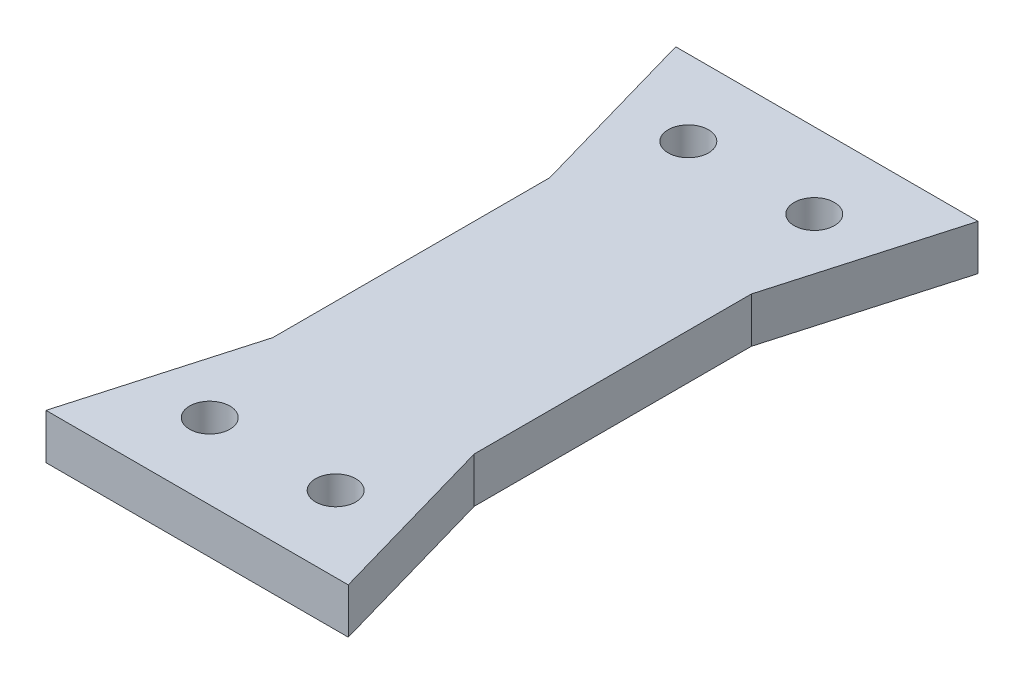
from build123d import *

# Parameters (mm, degrees)
SKETCH1_R           = 4
BOSS_EXTRUDE1_DEPTH = 9


with BuildPart() as part:
    # Sketch1 → Boss-Extrude1 (new body)
    with BuildSketch(Plane(origin=(0, 0, 0), x_dir=(1, 0, 0), z_dir=(0, 1, 0))):
        Polygon((-25, 45), (-30, 62.5), (30, 62.5), (25, 45), (20, 27.5), (20, -27.5), (25, -45), (30, -62.5), (-30, -62.5), (-25, -45), (-20, -27.5), (-20, 27.5), align=None)
        with Locations(Location((-12.5, 47.5, 0), (0, 0, 270))):
            Circle(SKETCH1_R, mode=Mode.SUBTRACT)
        with Locations(Location((12.5, 47.5, 0), (0, 0, 90))):
            Circle(SKETCH1_R, mode=Mode.SUBTRACT)
        with Locations(Location((12.5, -47.5, 0), (0, 0, 270))):
            Circle(SKETCH1_R, mode=Mode.SUBTRACT)
        with Locations(Location((-12.5, -47.5, 0), (0, 0, 90))):
            Circle(SKETCH1_R, mode=Mode.SUBTRACT)
    extrude(amount=BOSS_EXTRUDE1_DEPTH)


solid = part.part
